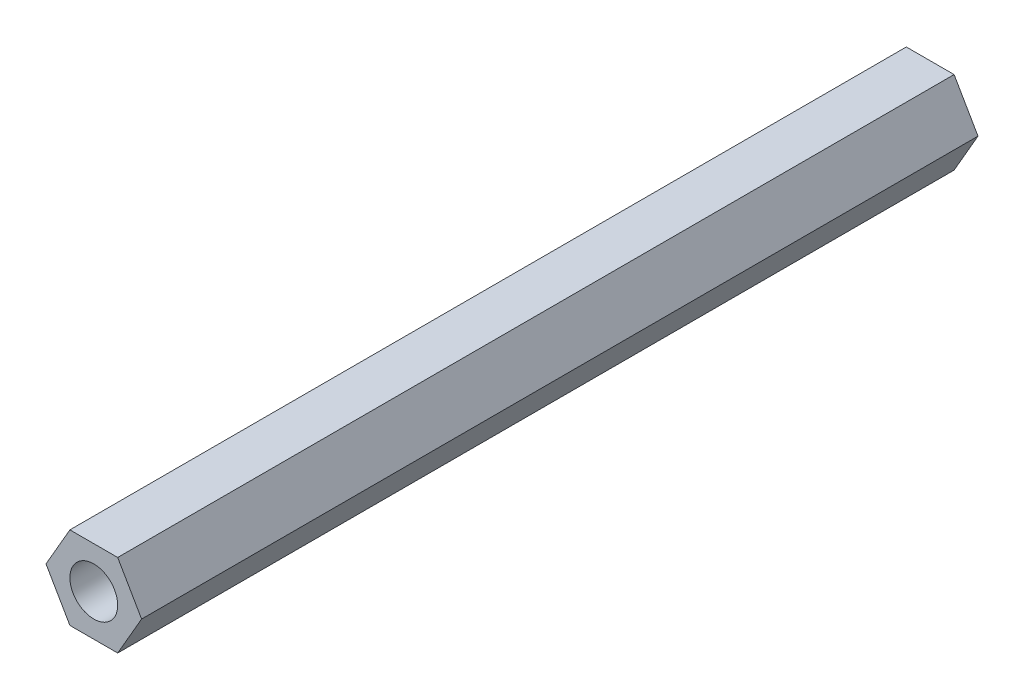
from build123d import *

# Parameters (mm, degrees)
SKETCH_1_R      = 2
EXTRUDE_1_DEPTH = 70


with BuildPart() as part:
    # 草图1 → 凸台-拉伸1 (new body)
    with BuildSketch(Plane.XY):
        Polygon((19.258254751, 75.577259039), (17.258254751, 79.041360654), (13.258254751, 79.041360654), (11.258254751, 75.577259039), (13.258254751, 72.113157424), (17.258254751, 72.113157424), align=None)
        with Locations((15.258254751, 75.577259039)):
            Circle(SKETCH_1_R, mode=Mode.SUBTRACT)
    extrude(amount=EXTRUDE_1_DEPTH)


solid = part.part
